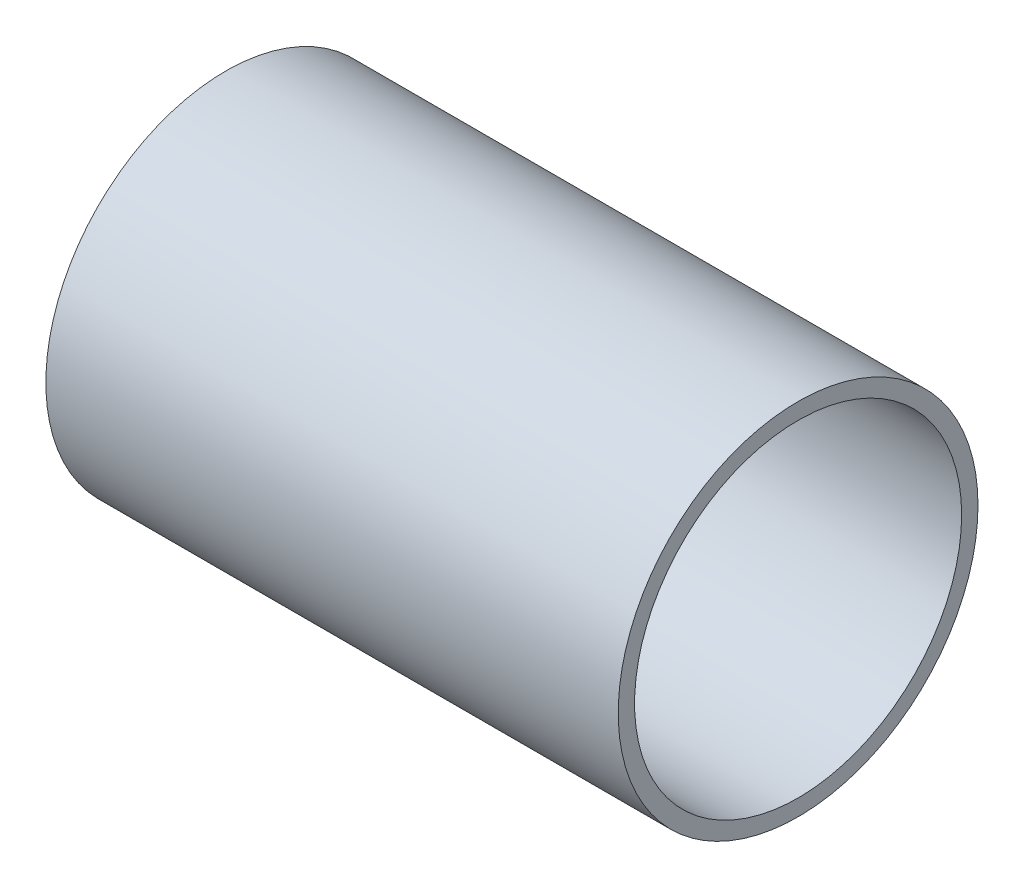
from build123d import *

# Parameters (mm, degrees)
SKETCH1_R           = 22
SKETCH1_R_2         = 20
BOSS_EXTRUDE1_DEPTH = 70


with BuildPart() as part:
    # Sketch1 → Boss-Extrude1 (new body)
    with BuildSketch(Plane(origin=(0, 0, 0), x_dir=(0, 0, -1), z_dir=(1, 0, 0))):
        Circle(SKETCH1_R)
        Circle(SKETCH1_R_2, mode=Mode.SUBTRACT)
    extrude(amount=BOSS_EXTRUDE1_DEPTH)


solid = part.part
